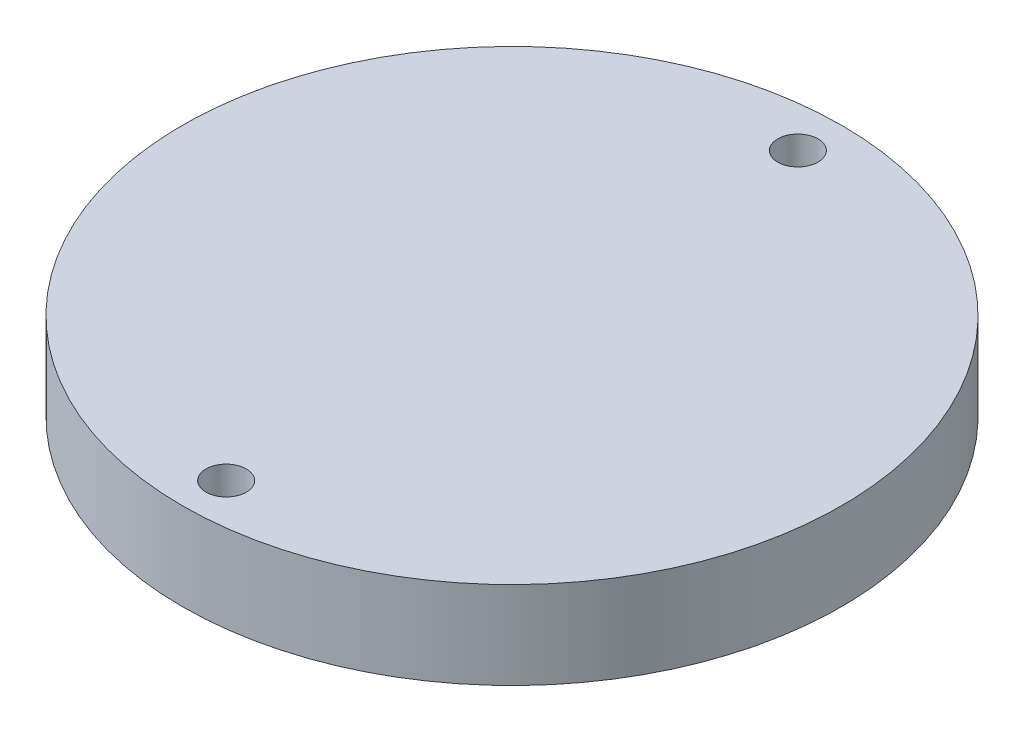
from build123d import *

# Parameters (mm, degrees)
SKETCH1_R           = 24.5
SKETCH1_R_2         = 18.5
BOSS_EXTRUDE1_DEPTH = 4.5
SKETCH2_R           = 24.5
BOSS_EXTRUDE2_DEPTH = 2
SKETCH3_R           = 1.5
CUT_EXTRUDE1_DEPTH  = 36.252659474


with BuildPart() as part:
    # Sketch1 → Boss-Extrude1 (new body)
    with BuildSketch(Plane(origin=(0, 0, 0), x_dir=(1, 0, 0), z_dir=(0, 1, 0))):
        with Locations(Location((0, 0, 0), (0, 0, 270))):
            Circle(SKETCH1_R)
        with Locations(Location((0, 0, 0), (0, 0, 270))):
            Circle(SKETCH1_R_2, mode=Mode.SUBTRACT)
    extrude(amount=BOSS_EXTRUDE1_DEPTH)

    # Sketch2 → Boss-Extrude2 (add)
    with BuildSketch(Plane(origin=(0, 4.5, 0), x_dir=(1, 0, 0), z_dir=(0, 1, 0))):
        with Locations(Location((0, 0, 0), (0, 0, 270))):
            Circle(SKETCH2_R)
    extrude(amount=BOSS_EXTRUDE2_DEPTH)

    # Sketch3 → Cut-Extrude1 (cut, through all)
    with BuildSketch(Plane.XZ):
        with Locations(Location((0, -21.25, 0), (0, 0, 270))):
            Circle(SKETCH3_R)
        with Locations(Location((0, 21.25, 0), (0, 0, 270))):
            Circle(SKETCH3_R)
    extrude(amount=-CUT_EXTRUDE1_DEPTH, mode=Mode.SUBTRACT)


solid = part.part
